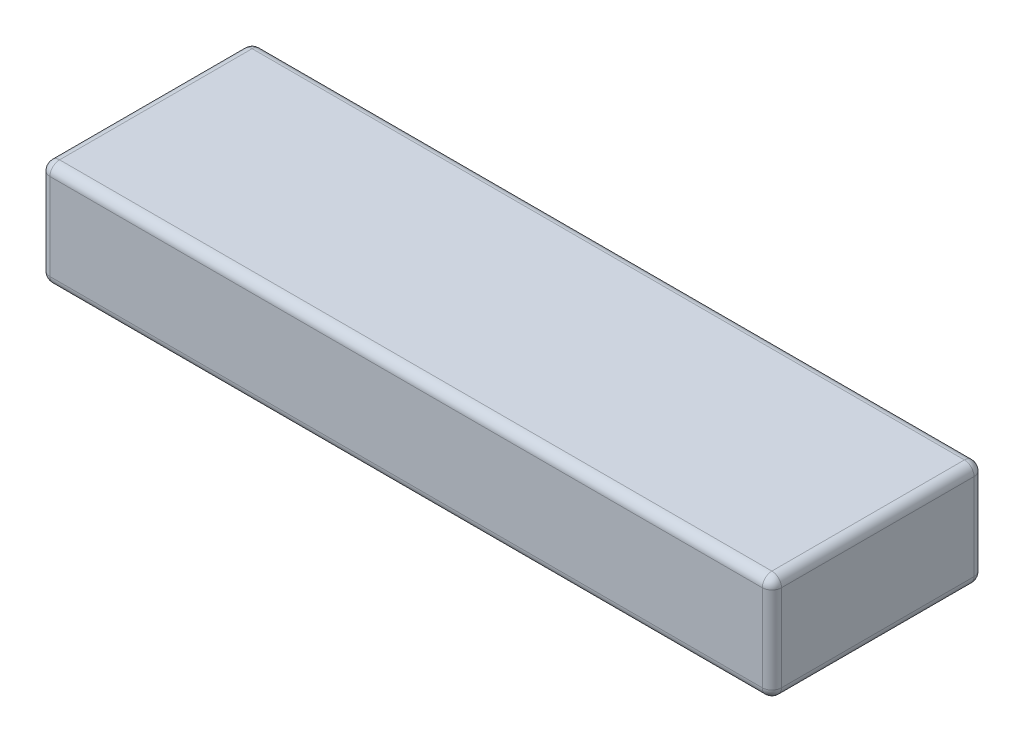
from build123d import *

# Parameters (mm, degrees)
SKETCH_1_W      = 152
SKETCH_1_H      = 44
EXTRUDE_1_DEPTH = 22
FILLET_1_R      = 2


with BuildPart() as part:
    # 草图1 → 凸台-拉伸1 (new body)
    with BuildSketch(Plane(origin=(0, 0, 0), x_dir=(1, 0, 0), z_dir=(0, 1, 0))):
        Rectangle(SKETCH_1_W, SKETCH_1_H)
    extrude(amount=EXTRUDE_1_DEPTH)

    # 圆角1
    fillet_1_edges = [part.edges().sort_by_distance(p)[0] for p in [
        (-76, 22, 0),
        (0, 22, 22),
        (76, 22, 0),
        (0, 0, 22),
        (-76, 0, 0),
        (0, 0, -22),
        (76, 0, 0),
        (76, 11, 22),
        (-76, 11, 22),
        (-76, 11, -22),
        (76, 11, -22),
        (0, 22, -22),
    ]]
    fillet(fillet_1_edges, radius=FILLET_1_R)


solid = part.part
